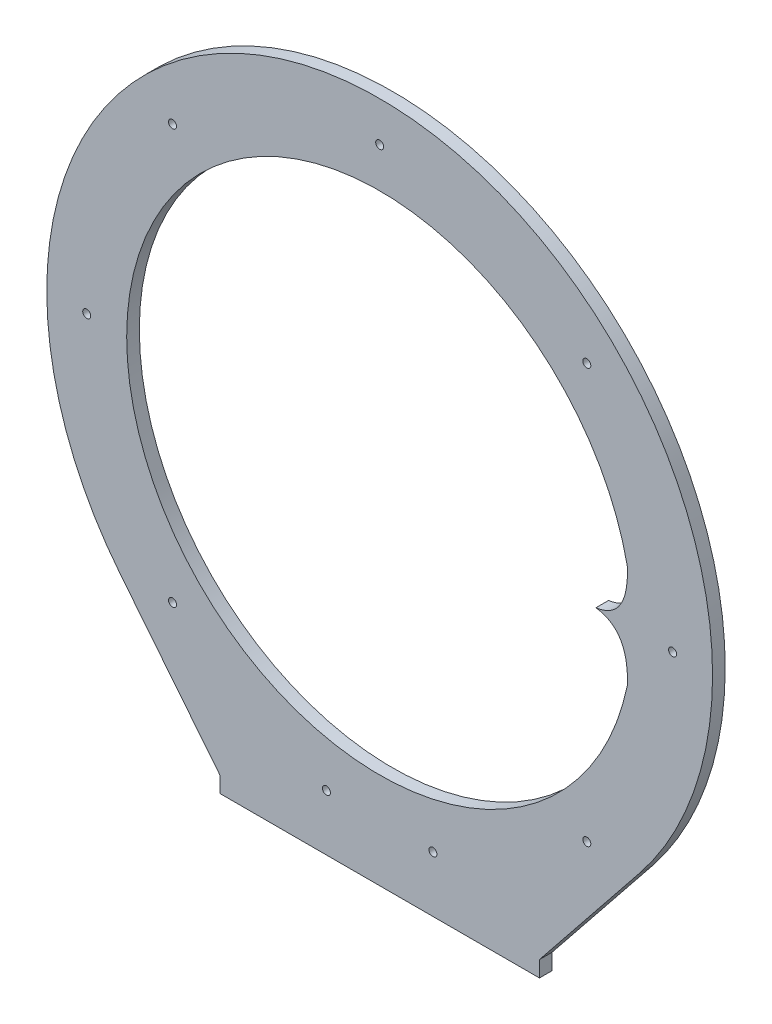
from build123d import *

# Parameters (mm, degrees)
SKETCH1_R           = 1.5
BOSS_EXTRUDE1_DEPTH = 4.75


with BuildPart() as part:
    # Sketch1 → Boss-Extrude1 (new body)
    with BuildSketch(Plane.XY):
        with BuildLine():
            Line((-97.529258778, -78.185955787), (-60, -125))
            Line((-60, -125), (-60, -131))
            Line((-60, -131), (60, -131))
            Line((60, -131), (60, -125))
            Line((60, -125), (97.529258778, -78.185955787))
            ThreePointArc((97.529258778, -78.185955787), (0, 125), (-97.529258778, -78.185955787))
        make_face()
        with Locations((-77.781745931, -77.781745931)):
            Circle(SKETCH1_R, mode=Mode.SUBTRACT)
        with Locations((-20, -110)):
            Circle(SKETCH1_R, mode=Mode.SUBTRACT)
        with Locations((20, -110)):
            Circle(SKETCH1_R, mode=Mode.SUBTRACT)
        with Locations((77.781745931, -77.781745931)):
            Circle(SKETCH1_R, mode=Mode.SUBTRACT)
        with Locations((-110, 0)):
            Circle(SKETCH1_R, mode=Mode.SUBTRACT)
        with BuildLine():
            ThreePointArc((93.01577046, -19.314928054), (-95, 0), (93.01577046, 19.314928054))
            add(Edge.make_bspline(
                [(93.01577046, 19.314928054), (93.70285757, 1.722452045), (81.198007465, 0)],
                knots=[0, 0, 0, 1, 1, 1], degree=2))
            add(Edge.make_bspline(
                [(93.01577046, -19.314928054), (93.70285757, -1.722452045), (81.198007465, 0)],
                knots=[0, 0, 0, 1, 1, 1], degree=2))
        make_face(mode=Mode.SUBTRACT)
        with Locations((-77.781745931, 77.781745931)):
            Circle(SKETCH1_R, mode=Mode.SUBTRACT)
        with Locations((110, 0)):
            Circle(SKETCH1_R, mode=Mode.SUBTRACT)
        with Locations((0, 110)):
            Circle(SKETCH1_R, mode=Mode.SUBTRACT)
        with Locations((77.781745931, 77.781745931)):
            Circle(SKETCH1_R, mode=Mode.SUBTRACT)
    extrude(amount=BOSS_EXTRUDE1_DEPTH)


solid = part.part
